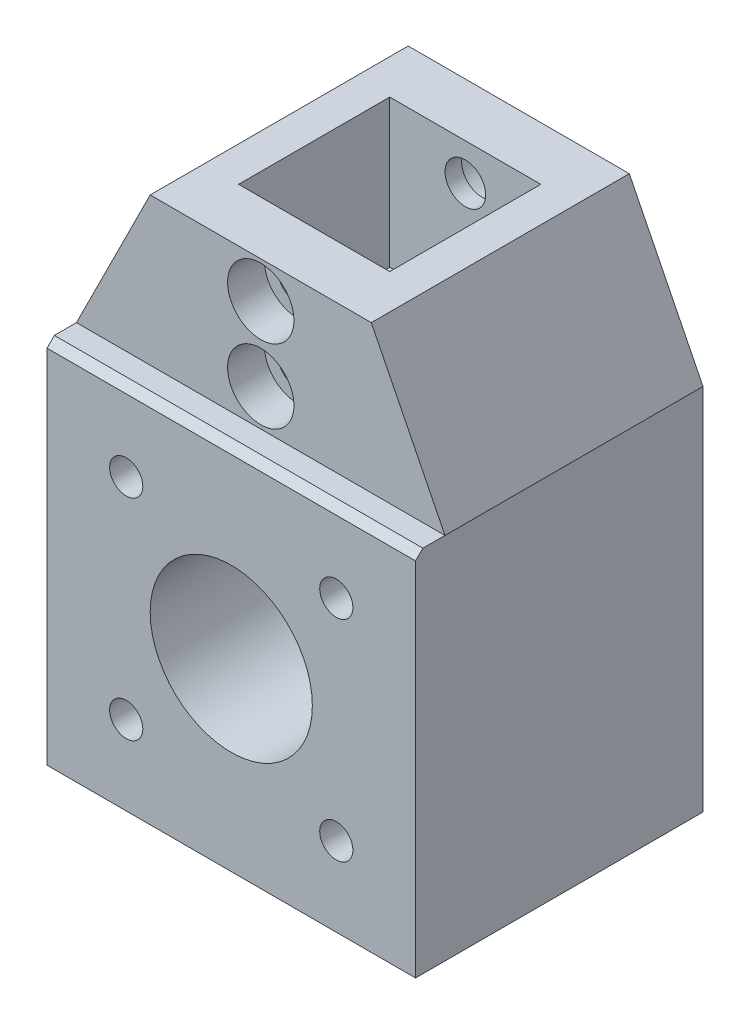
from build123d import *

# Parameters (mm, degrees)
SKETCH1_R            = 11
BODY_DEPTH           = 17.5
SKETCH4_W            = 20.5
SKETCH4_H            = 20.5
PROFIL_HOLE_DEPTH    = 20
M4_CLEARANCE_HOLE1_D = 4.5
M5_CLEARANCE_HOLE1_D = 5.5
ELEVATION_START      = 4
SKETCH10_W           = 50
SKETCH10_H           = 50
SKETCH10_R           = 2.25
SKETCH10_R_2         = 11
ELEVATION_DEPTH      = 4
SKETCH11_R           = 3.2
INSERTS_HOLES_DEPTH  = 9.5
SKETCH12_R           = 4.5
M5_VIS_PLACE_DEPTH   = 5
SKETCH13_R           = 3.75
M4_SCREW_PLACE_DEPTH = 4
CHAMFER1_SIZE        = 1


with BuildPart() as part:
    # Sketch1 → Body (new, symmetric)
    with BuildSketch(Plane.XY):
        Polygon((-25, 25), (-15, 45), (15, 45), (25, 25), (25, -25), (-25, -25), align=None)
        Circle(SKETCH1_R, mode=Mode.SUBTRACT)
    extrude(amount=BODY_DEPTH, both=True)

    # Sketch4 → Profil_Hole (cut)
    with BuildSketch(Plane(origin=(0, 45, 0), x_dir=(1, 0, 0), z_dir=(0, 1, 0))):
        Rectangle(SKETCH4_W, SKETCH4_H)
    extrude(amount=-PROFIL_HOLE_DEPTH, mode=Mode.SUBTRACT)

    # M4 Clearance Hole1 (through all)
    with Locations(Plane(origin=(0, 0, -17.5), x_dir=(-1, 0, 0), z_dir=(0, 0, -1))):
        with Locations((0, 0), (-14.25, 14.25), (14.25, -14.25), (14.25, 14.25), (-14.25, -14.25)):
            Hole(M4_CLEARANCE_HOLE1_D / 2)

    # M5 Clearance Hole1 (through all)
    with Locations(Plane(origin=(0, 0, -17.5), x_dir=(-1, 0, 0), z_dir=(0, 0, -1))):
        with Locations((0, 40), (0, 30)):
            Hole(M5_CLEARANCE_HOLE1_D / 2)

    # Sketch10 → Elevation (add)
    with BuildSketch(Plane.XY.offset(17.5).offset(ELEVATION_START)):
        Rectangle(SKETCH10_W, SKETCH10_H)
        with Locations(Location((-14.25, -14.25, 0), (0, 0, 180))):
            Circle(SKETCH10_R, mode=Mode.SUBTRACT)
        with Locations(Location((14.25, -14.25, 0), (0, 0, 180))):
            Circle(SKETCH10_R, mode=Mode.SUBTRACT)
        with Locations(Location((14.25, 14.25, 0), (0, 0, 180))):
            Circle(SKETCH10_R, mode=Mode.SUBTRACT)
        Circle(SKETCH10_R_2, mode=Mode.SUBTRACT)
        with Locations(Location((-14.25, 14.25, 0), (0, 0, 180))):
            Circle(SKETCH10_R, mode=Mode.SUBTRACT)
    extrude(amount=-ELEVATION_DEPTH)

    # Sketch11 → Inserts_Holes (cut)
    with BuildSketch(Plane(origin=(0, 0, -17.5), x_dir=(-1, 0, 0), z_dir=(0, 0, -1))):
        with Locations((-18, 0)):
            Circle(SKETCH11_R)
        with Locations(Location((18, 0, 0), (0, 0, 180))):
            Circle(SKETCH11_R)
    extrude(amount=-INSERTS_HOLES_DEPTH, mode=Mode.SUBTRACT)

    # Sketch12 → M5_Vis_Place (cut)
    with BuildSketch(Plane(origin=(0, 0, -17.5), x_dir=(-1, 0, 0), z_dir=(0, 0, -1))):
        with Locations((0, 40)):
            Circle(SKETCH12_R)
        with Locations((0, 30)):
            Circle(SKETCH12_R)
    m5_vis_place = extrude(amount=-M5_VIS_PLACE_DEPTH, mode=Mode.SUBTRACT)

    # Mirror1: M5_Vis_Place across plane
    add(m5_vis_place.mirror(Plane.XY), mode=Mode.SUBTRACT)

    # Sketch13 → M4_Screw_Place (cut)
    with BuildSketch(Plane(origin=(0, 0, -17.5), x_dir=(-1, 0, 0), z_dir=(0, 0, -1))):
        with Locations((-14.25, 14.25)):
            Circle(SKETCH13_R)
        with Locations((14.25, 14.25)):
            Circle(SKETCH13_R)
        with Locations((14.25, -14.25)):
            Circle(SKETCH13_R)
        with Locations((-14.25, -14.25)):
            Circle(SKETCH13_R)
    extrude(amount=-M4_SCREW_PLACE_DEPTH, mode=Mode.SUBTRACT)

    # Chamfer1
    chamfer1_edges = [part.edges().sort_by_distance(p)[0] for p in [
        (0, 25, 21.5),
    ]]
    chamfer(chamfer1_edges, length=CHAMFER1_SIZE)


solid = part.part
